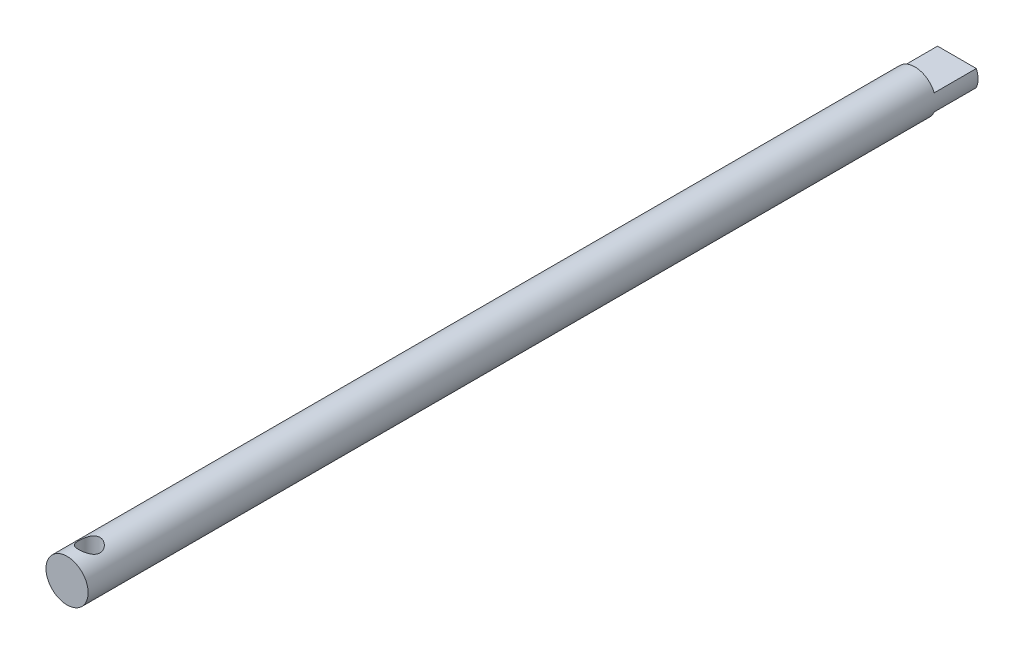
from build123d import *

# Parameters (mm, degrees)
SKETCH1_R           = 3.175
BOSS_EXTRUDE1_DEPTH = 134
CUT_EXTRUDE1_DEPTH  = 6.34
SKETCH5_R           = 1.6
CUT_EXTRUDE2_DEPTH  = 135.187939566


with BuildPart() as part:
    # Sketch1 → Boss-Extrude1 (new body)
    with BuildSketch(Plane.XY):
        Circle(SKETCH1_R)
    extrude(amount=BOSS_EXTRUDE1_DEPTH)

    # Sketch2 → Cut-Extrude1 (cut)
    with BuildSketch(Plane(origin=(0, 0, 0), x_dir=(-1, 0, 0), z_dir=(0, 0, -1))):
        with BuildLine():
            ThreePointArc((2.918582704, 1.25), (0, 3.175), (-2.918582704, 1.25))
            Line((-2.918582704, 1.25), (2.918582704, 1.25))
        make_face()
        with BuildLine():
            Line((2.918582704, -1.25), (-2.918582704, -1.25))
            ThreePointArc((-2.918582704, -1.25), (0, -3.175), (2.918582704, -1.25))
        make_face()
    extrude(amount=-CUT_EXTRUDE1_DEPTH, mode=Mode.SUBTRACT)

    # Sketch5 → Cut-Extrude2 (cut, through all)
    with BuildSketch(Plane(origin=(0, 3.175, 0), x_dir=(1, 0, 0), z_dir=(0, 1, 0))):
        with Locations(Location((0, -130.65, 0), (0, 0, 270))):
            Circle(SKETCH5_R)
    extrude(amount=-CUT_EXTRUDE2_DEPTH, mode=Mode.SUBTRACT)


solid = part.part
